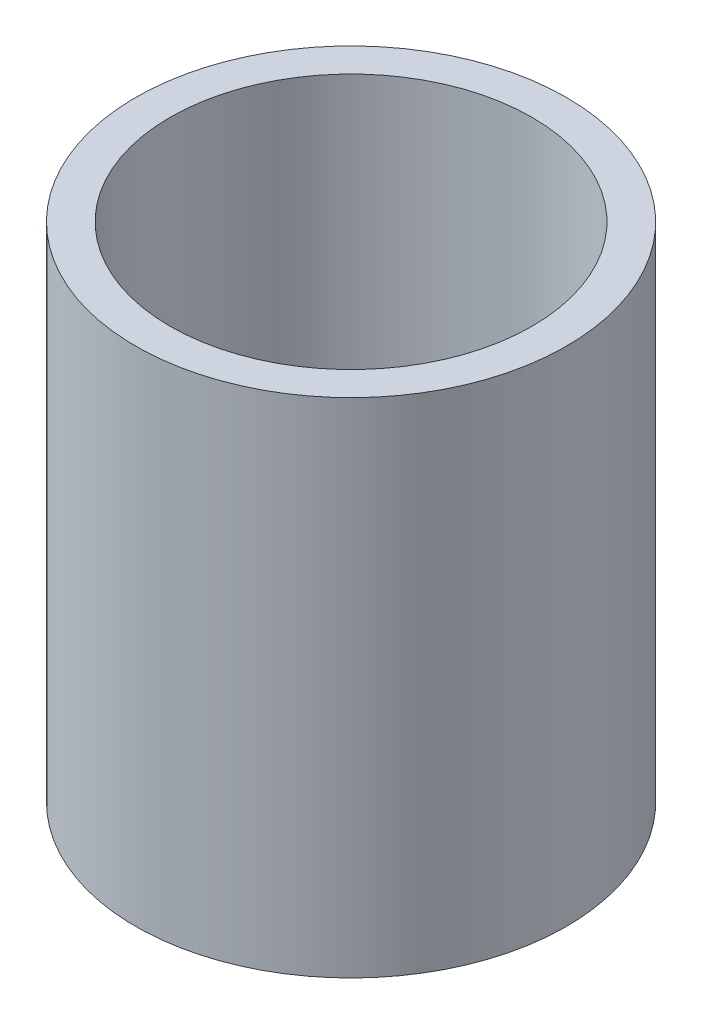
from build123d import *

# Parameters (mm, degrees)
SKETCH_1_R      = 36
SKETCH_1_R_2    = 30.25
EXTRUDE_1_DEPTH = 84


with BuildPart() as part:
    # 스케치1 → 보스-돌출1 (new body)
    with BuildSketch(Plane(origin=(0, 0, 0), x_dir=(1, 0, 0), z_dir=(0, 1, 0))):
        with Locations(Location((0, 0, 0), (0, 0, 90))):
            Circle(SKETCH_1_R)
        with Locations(Location((0, 0, 0), (0, 0, 90))):
            Circle(SKETCH_1_R_2, mode=Mode.SUBTRACT)
    extrude(amount=EXTRUDE_1_DEPTH)


solid = part.part
